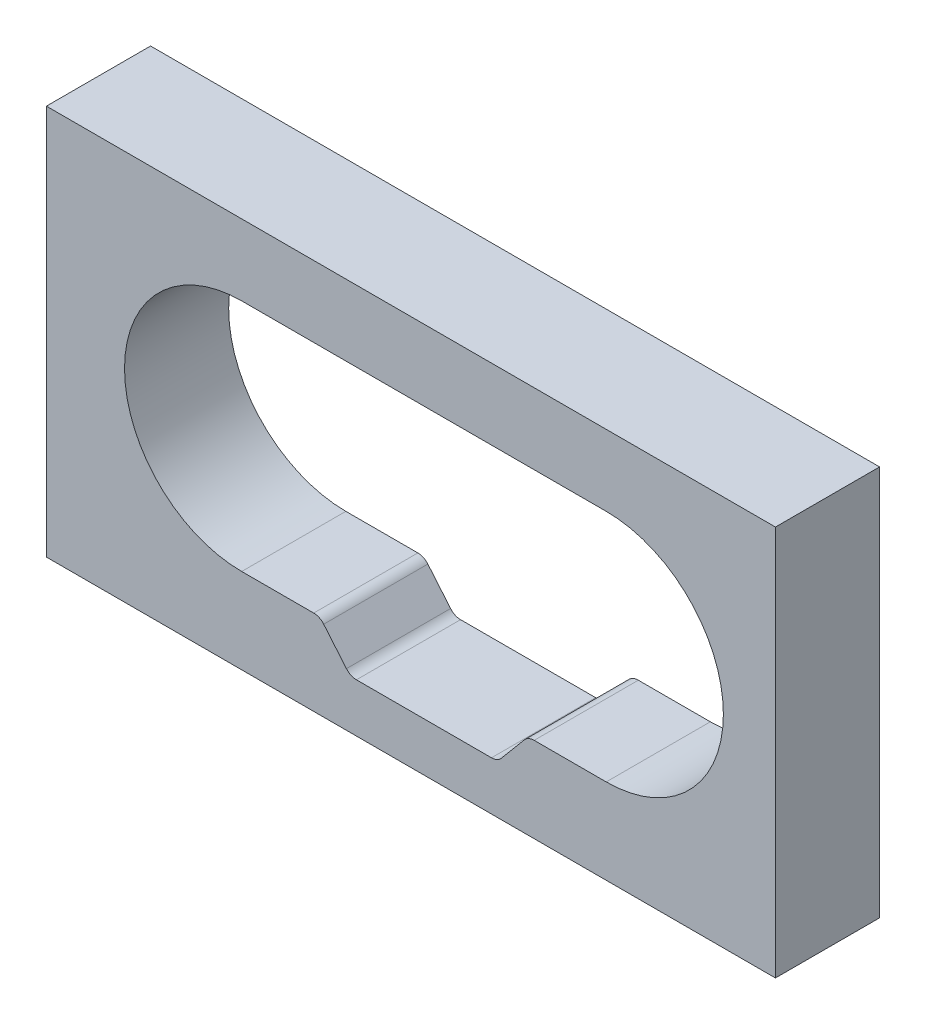
from build123d import *

# Parameters (mm, degrees)
SKETCH_1_W      = 56
SKETCH_1_H      = 30
EXTRUDE_1_DEPTH = 8
FILLET_1_R      = 1


with BuildPart() as part:
    # 草图1 → 凸台-拉伸1 (new body)
    with BuildSketch(Plane.XY):
        with Locations((13, -0.54396632)):
            Rectangle(SKETCH_1_W, SKETCH_1_H)
        with BuildLine():
            Line((0, 9), (28, 9))
            ThreePointArc((28, 9), (37, 0), (28, -9))
            Line((28, -9), (22, -9))
            Line((22, -9), (19.655104495, -11.8))
            Line((19.655104495, -11.8), (8.344895505, -11.8))
            Line((8.344895505, -11.8), (6, -9))
            Line((6, -9), (0, -9))
            ThreePointArc((0, -9), (-9, 0), (0, 9))
        make_face(mode=Mode.SUBTRACT)
    extrude(amount=EXTRUDE_1_DEPTH)

    # 圆角1
    fillet_1_edges = [part.edges().sort_by_distance(p)[0] for p in [
        (6, -9, 4),
        (8.344895505, -11.8, 4),
        (19.655104495, -11.8, 4),
        (22, -9, 4),
    ]]
    fillet(fillet_1_edges, radius=FILLET_1_R)


solid = part.part
